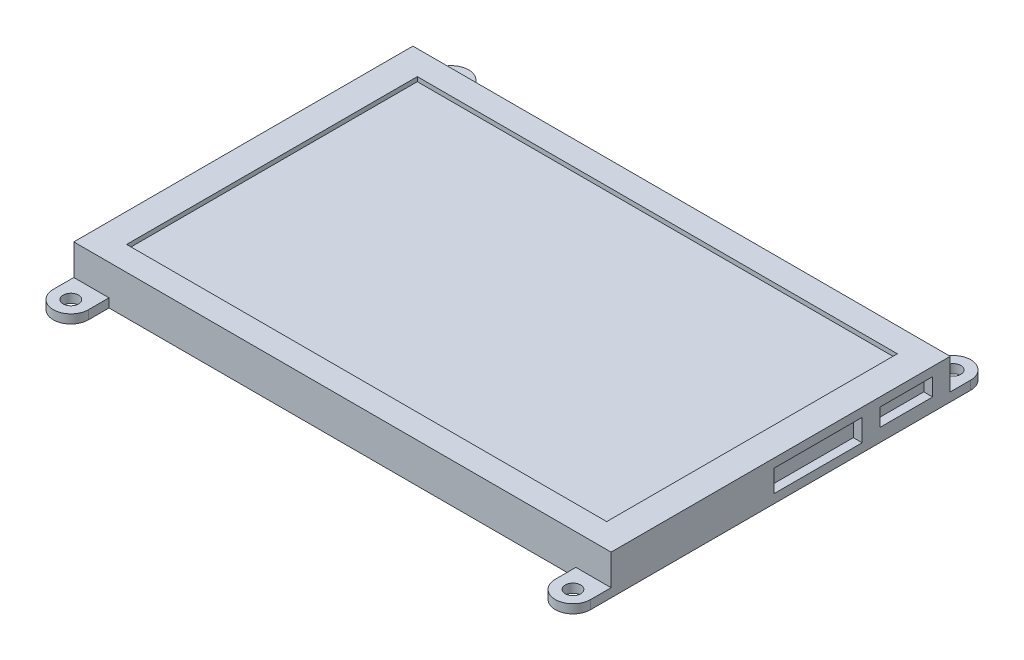
from build123d import *

# Parameters (mm, degrees)
SKETCH1_W           = 122
SKETCH1_H           = 77
BOSS_EXTRUDE1_DEPTH = 9
SKETCH2_W           = 109
SKETCH2_H           = 66
CUT_EXTRUDE1_DEPTH  = 1
BOSS_EXTRUDE2_DEPTH = 2
SKETCH4_R           = 1.75
CUT_EXTRUDE3_DEPTH  = 4
SKETCH5_W           = 12
SKETCH5_H           = 4
SKETCH5_W_2         = 20
SKETCH5_H_2         = 5
CUT_EXTRUDE4_DEPTH  = 2


with BuildPart() as part:
    # Sketch1 → Boss-Extrude1 (new body)
    with BuildSketch(Plane(origin=(0, 0, 0), x_dir=(1, 0, 0), z_dir=(0, 1, 0))):
        with Locations((61, 38.5)):
            Rectangle(SKETCH1_W, SKETCH1_H)
    extrude(amount=BOSS_EXTRUDE1_DEPTH)

    # Sketch2 → Cut-Extrude1 (cut)
    with BuildSketch(Plane(origin=(0, 9, 0), x_dir=(1, 0, 0), z_dir=(0, 1, 0))):
        with Locations((61, 38.5)):
            Rectangle(SKETCH2_W, SKETCH2_H)
    extrude(amount=-CUT_EXTRUDE1_DEPTH, mode=Mode.SUBTRACT)

    # Sketch3 → Boss-Extrude2 (add)
    with BuildSketch(Plane.XZ):
        with BuildLine():
            Line((0, -81.66), (0, -72.34))
            ThreePointArc((0, -72.34), (4, -68.34), (8, -72.34))
            Line((8, -72.34), (8, -81.66))
            ThreePointArc((8, -81.66), (4, -85.66), (0, -81.66))
        make_face()
        with BuildLine():
            Line((122, -81.66), (122, -72.34))
            ThreePointArc((122, -72.34), (118, -68.34), (114, -72.34))
            Line((114, -72.34), (114, -81.66))
            ThreePointArc((114, -81.66), (118, -85.66), (122, -81.66))
        make_face()
        with BuildLine():
            Line((0, 4.66), (0, -4.66))
            ThreePointArc((0, -4.66), (4, -8.66), (8, -4.66))
            Line((8, -4.66), (8, 4.66))
            ThreePointArc((8, 4.66), (4, 8.66), (0, 4.66))
        make_face()
        with BuildLine():
            Line((122, 4.66), (122, -4.66))
            ThreePointArc((122, -4.66), (118, -8.66), (114, -4.66))
            Line((114, -4.66), (114, 4.66))
            ThreePointArc((114, 4.66), (118, 8.66), (122, 4.66))
        make_face()
    extrude(amount=-BOSS_EXTRUDE2_DEPTH)

    # Sketch4 → Cut-Extrude3 (cut)
    with BuildSketch(Plane.XZ):
        with Locations(Location((4, -81.66, 0), (0, 0, 270))):
            Circle(SKETCH4_R)
        with Locations(Location((118, -81.66, 0), (0, 0, 90))):
            Circle(SKETCH4_R)
        with Locations(Location((4, 4.66, 0), (0, 0, 90))):
            Circle(SKETCH4_R)
        with Locations(Location((118, 4.66, 0), (0, 0, 270))):
            Circle(SKETCH4_R)
    extrude(amount=-CUT_EXTRUDE3_DEPTH, mode=Mode.SUBTRACT)

    # Sketch5 → Cut-Extrude4 (cut)
    with BuildSketch(Plane(origin=(122, 0, 0), x_dir=(0, 0, -1), z_dir=(1, 0, 0))):
        with Locations((67, 5)):
            Rectangle(SKETCH5_W, SKETCH5_H)
        with Locations((47, 4.5)):
            Rectangle(SKETCH5_W_2, SKETCH5_H_2)
    extrude(amount=-CUT_EXTRUDE4_DEPTH, mode=Mode.SUBTRACT)


solid = part.part
